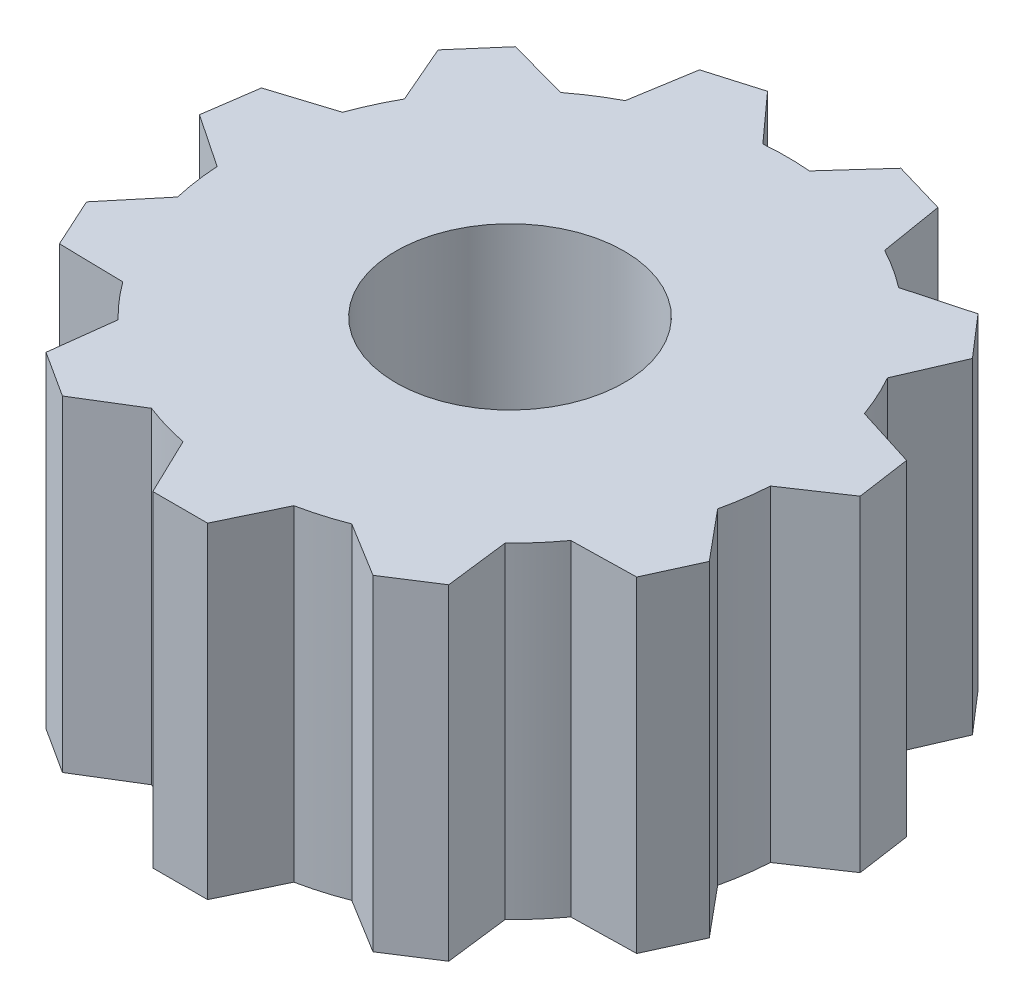
from build123d import *

# Parameters (mm, degrees)
SKETCH1_R            = 3.5
BOSS_EXTRUDE1_DEPTH  = 5
SKETCH12_R           = 8.5
SKETCH12_R_2         = 3.5
BOSS_EXTRUDE6_DEPTH  = 5
BOSS_EXTRUDE9_DEPTH  = 5
CIRPATTERN2_COUNT    = 11
CUT_EXTRUDE1_START   = -10
SKETCH14_R           = 3.5
CUT_EXTRUDE1_DEPTH   = 10
SKETCH17_R           = 3.5
BOSS_EXTRUDE10_DEPTH = 5
BOSS_EXTRUDE11_DEPTH = 5


with BuildPart() as part:
    # Sketch1 → Boss-Extrude1 (new body)
    with BuildSketch(Plane(origin=(0, 0, 0), x_dir=(1, 0, 0), z_dir=(0, 1, 0))):
        with Locations(Location((0, 0, 0), (0, 0, 270))):
            Circle(SKETCH1_R)
    extrude(amount=BOSS_EXTRUDE1_DEPTH)

    # Sketch14 → Cut-Extrude1 (cut)
    with BuildSketch(Plane(origin=(0, 5, 0), x_dir=(1, 0, 0), z_dir=(0, 1, 0)).offset(CUT_EXTRUDE1_START)):
        with Locations(Location((0, 0, 0), (0, 0, 90))):
            Circle(SKETCH14_R)
    extrude(amount=CUT_EXTRUDE1_DEPTH, mode=Mode.SUBTRACT)


with BuildPart() as body_2:
    # Sketch12 → Boss-Extrude6 (new body)
    with BuildSketch(Plane(origin=(0, 5, 0), x_dir=(-1, 0, 0), z_dir=(0, -1, 0))):
        with Locations(Location((0, 0, 0), (0, 0, 90))):
            Circle(SKETCH12_R)
        with Locations(Location((0, 0, 0), (0, 0, 90))):
            Circle(SKETCH12_R_2, mode=Mode.SUBTRACT)
    extrude(amount=BOSS_EXTRUDE6_DEPTH)



with BuildPart() as body_3:
    # Sketch13 → Boss-Extrude9 (new body)
    with BuildSketch(Plane.XZ):
        with BuildLine():
            Line((1.7, 8.328265125), (0.84, 10.115181659))
            Line((0.84, 10.115181659), (-0.84, 10.115181659))
            Line((-0.84, 10.115181659), (-1.7, 8.328265125))
            ThreePointArc((-1.7, 8.328265125), (0, 8.5), (1.7, 8.328265125))
        make_face()
    extrude(amount=-BOSS_EXTRUDE9_DEPTH)


with BuildPart() as cirpattern2_1:
    # CirPattern2: pattern copy
    add(body_3.part.rotate(Axis((0, 0, 0), (0, 1, 0)), 1 * 360 / CIRPATTERN2_COUNT))


with BuildPart() as cirpattern2_2:
    # CirPattern2: pattern copy
    add(body_3.part.rotate(Axis((0, 0, 0), (0, 1, 0)), 2 * 360 / CIRPATTERN2_COUNT))


with BuildPart() as cirpattern2_3:
    # CirPattern2: pattern copy
    add(body_3.part.rotate(Axis((0, 0, 0), (0, 1, 0)), 3 * 360 / CIRPATTERN2_COUNT))


with BuildPart() as cirpattern2_4:
    # CirPattern2: pattern copy
    add(body_3.part.rotate(Axis((0, 0, 0), (0, 1, 0)), 4 * 360 / CIRPATTERN2_COUNT))


with BuildPart() as cirpattern2_5:
    # CirPattern2: pattern copy
    add(body_3.part.rotate(Axis((0, 0, 0), (0, 1, 0)), 5 * 360 / CIRPATTERN2_COUNT))


with BuildPart() as cirpattern2_6:
    # CirPattern2: pattern copy
    add(body_3.part.rotate(Axis((0, 0, 0), (0, 1, 0)), 6 * 360 / CIRPATTERN2_COUNT))


with BuildPart() as cirpattern2_7:
    # CirPattern2: pattern copy
    add(body_3.part.rotate(Axis((0, 0, 0), (0, 1, 0)), 7 * 360 / CIRPATTERN2_COUNT))


with BuildPart() as cirpattern2_8:
    # CirPattern2: pattern copy
    add(body_3.part.rotate(Axis((0, 0, 0), (0, 1, 0)), 8 * 360 / CIRPATTERN2_COUNT))


with BuildPart() as cirpattern2_9:
    # CirPattern2: pattern copy
    add(body_3.part.rotate(Axis((0, 0, 0), (0, 1, 0)), 9 * 360 / CIRPATTERN2_COUNT))


with BuildPart() as cirpattern2_10:
    # CirPattern2: pattern copy
    add(body_3.part.rotate(Axis((0, 0, 0), (0, 1, 0)), 10 * 360 / CIRPATTERN2_COUNT))


with BuildPart() as body_2_1:
    add(body_2.part)

    add(body_3.part)  # Boss-Extrude10 merges body 3

    add(cirpattern2_2.part)  # Boss-Extrude10 merges CirPattern2_2

    add(cirpattern2_3.part)  # Boss-Extrude10 merges CirPattern2_3

    add(cirpattern2_4.part)  # Boss-Extrude10 merges CirPattern2_4

    add(cirpattern2_5.part)  # Boss-Extrude10 merges CirPattern2_5

    add(cirpattern2_6.part)  # Boss-Extrude10 merges CirPattern2_6

    add(cirpattern2_7.part)  # Boss-Extrude10 merges CirPattern2_7

    add(cirpattern2_8.part)  # Boss-Extrude10 merges CirPattern2_8

    add(cirpattern2_9.part)  # Boss-Extrude10 merges CirPattern2_9

    add(cirpattern2_10.part)  # Boss-Extrude10 merges CirPattern2_10
    # Sketch17 → Boss-Extrude10 (add)
    with BuildSketch(Plane.XZ):
        with BuildLine():
            Line((5.180819576, -6.738628089), (7.094461217, -7.258864928))
            Line((7.094461217, -7.258864928), (8.19462725, -5.989205643))
            Line((8.19462725, -5.989205643), (7.407346071, -4.169079536))
            ThreePointArc((7.407346071, -4.169079536), (7.731871961, -3.531027611), (8.00156017, -2.867932156))
            Line((8.00156017, -2.867932156), (9.892679231, -2.270990453))
            Line((9.892679231, -2.270990453), (10.131768159, -0.608090431))
            Line((10.131768159, -0.608090431), (8.48543062, 0.497460747))
            ThreePointArc((8.48543062, 0.497460747), (8.413482256, 1.209676125), (8.281861946, 1.913311973))
            Line((8.281861946, 1.913311973), (9.550041487, 3.437907444))
            Line((9.550041487, 3.437907444), (8.852144265, 4.966089197))
            Line((8.852144265, 4.966089197), (6.869450902, 5.006060757))
            ThreePointArc((6.869450902, 5.006060757), (4.595446948, 7.150655029), (1.7, 8.328265125))
            Line((1.7, 8.328265125), (0.84, 10.115181659))
            Line((0.84, 10.115181659), (-0.84, 10.115181659))
            Line((-0.84, 10.115181659), (-1.7, 8.328265125))
            ThreePointArc((-1.7, 8.328265125), (-2.394726733, 8.155690276), (-3.07246906, 7.925271849))
            Line((-3.07246906, 7.925271849), (-4.762027113, 8.963570593))
            Line((-4.762027113, 8.963570593), (-6.175333049, 8.055294019))
            Line((-6.175333049, 8.055294019), (-5.932731071, 6.087093069))
            ThreePointArc((-5.932731071, 6.087093069), (-6.423871382, 5.566316239), (-6.869450902, 5.006060757))
            Line((-6.869450902, 5.006060757), (-8.852144265, 4.966089197))
            Line((-8.852144265, 4.966089197), (-9.550041487, 3.437907444))
            Line((-9.550041487, 3.437907444), (-8.281861946, 1.913311973))
            ThreePointArc((-8.281861946, 1.913311973), (-8.413482256, 1.209676125), (-8.48543062, 0.497460747))
            Line((-8.48543062, 0.497460747), (-10.131768159, -0.608090431))
            Line((-10.131768159, -0.608090431), (-9.892679231, -2.270990453))
            Line((-9.892679231, -2.270990453), (-8.00156017, -2.867932156))
            ThreePointArc((-8.00156017, -2.867932156), (-7.731871961, -3.531027611), (-7.407346071, -4.169079536))
            Line((-7.407346071, -4.169079536), (-8.19462725, -5.989205643))
            Line((-8.19462725, -5.989205643), (-7.094461217, -7.258864928))
            Line((-7.094461217, -7.258864928), (-5.180819576, -6.738628089))
            ThreePointArc((-5.180819576, -6.738628089), (-4.595446948, -7.150655029), (-3.977481483, -7.511966524))
            Line((-3.977481483, -7.511966524), (-3.65575009, -9.468790381))
            Line((-3.65575009, -9.468790381), (-2.043801894, -9.942101077))
            Line((-2.043801894, -9.942101077), (-0.715205373, -8.469857217))
            ThreePointArc((-0.715205373, -8.469857217), (0, -8.5), (0.715205373, -8.469857217))
            Line((0.715205373, -8.469857217), (2.043801894, -9.942101077))
            Line((2.043801894, -9.942101077), (3.65575009, -9.468790381))
            Line((3.65575009, -9.468790381), (3.977481483, -7.511966524))
            ThreePointArc((3.977481483, -7.511966524), (4.595446948, -7.150655029), (5.180819576, -6.738628089))
        make_face()
        with Locations(Location((0, 0, 0), (0, 0, 270))):
            Circle(SKETCH17_R, mode=Mode.SUBTRACT)
    extrude(amount=BOSS_EXTRUDE10_DEPTH)


    add(cirpattern2_1.part)  # Boss-Extrude11 merges CirPattern2_1
    # Sketch18 → Boss-Extrude11 (add)
    with BuildSketch(Plane.XZ):
        with BuildLine():
            Line((6.175333049, 8.055294019), (4.762027113, 8.963570593))
            Line((4.762027113, 8.963570593), (3.07246906, 7.925271849))
            ThreePointArc((3.07246906, 7.925271849), (4.595446948, 7.150655029), (5.932731071, 6.087093069))
            Line((5.932731071, 6.087093069), (6.175333049, 8.055294019))
        make_face()
    extrude(amount=BOSS_EXTRUDE11_DEPTH)


solid = body_2_1.part
